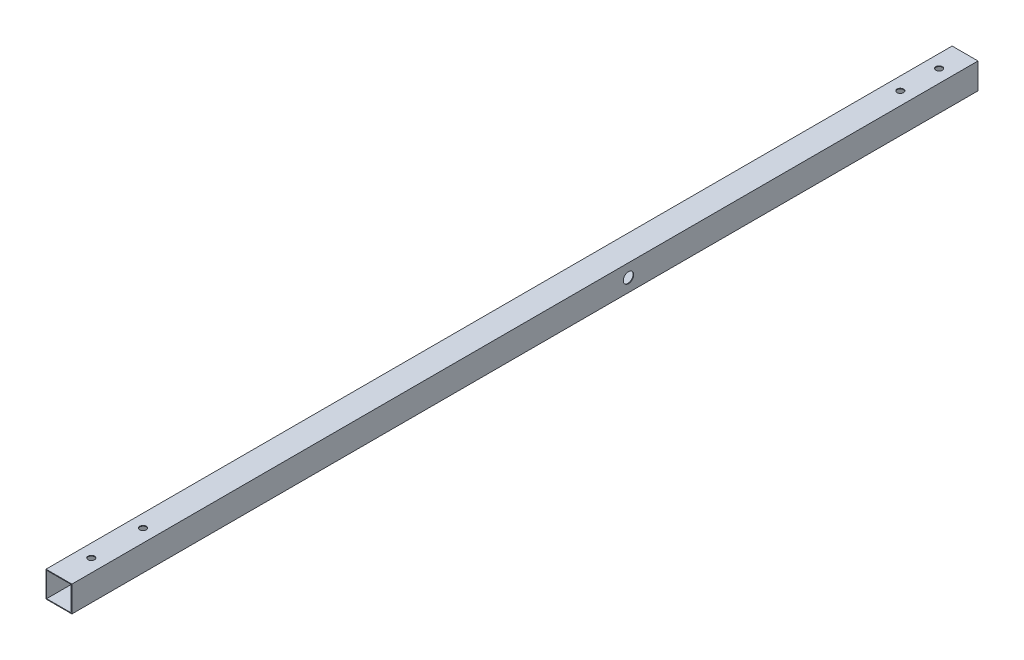
from build123d import *

# Parameters (mm, degrees)
SKETCH2_W           = 20
SKETCH2_H           = 20
BOSS_EXTRUDE1_DEPTH = 700
SKETCH3_W           = 19
SKETCH3_H           = 19
CUT_EXTRUDE1_DEPTH  = 700
SKETCH5_R           = 2.5
CUT_EXTRUDE2_DEPTH  = 20
SKETCH6_R           = 4
CUT_EXTRUDE3_DEPTH  = 20
SKETCH7_R           = 2.5
CUT_EXTRUDE4_DEPTH  = 20


with BuildPart() as part:
    # Sketch2 → Boss-Extrude1 (new body)
    with BuildSketch(Plane.XY):
        Rectangle(SKETCH2_W, SKETCH2_H)
    extrude(amount=BOSS_EXTRUDE1_DEPTH)

    # Sketch3 → Cut-Extrude1 (cut)
    with BuildSketch(Plane(origin=(0, 0, 0), x_dir=(-1, 0, 0), z_dir=(0, 0, -1))):
        Rectangle(SKETCH3_W, SKETCH3_H)
    extrude(amount=-CUT_EXTRUDE1_DEPTH, mode=Mode.SUBTRACT)

    # Sketch5 → Cut-Extrude2 (cut)
    with BuildSketch(Plane.XZ.offset(10)):
        with Locations(Location((0, 635, 0), (0, 0, 270))):
            Circle(SKETCH5_R)
        with Locations(Location((0, 675, 0), (0, 0, 270))):
            Circle(SKETCH5_R)
    extrude(amount=-CUT_EXTRUDE2_DEPTH, mode=Mode.SUBTRACT)

    # Sketch6 → Cut-Extrude3 (cut)
    with BuildSketch(Plane(origin=(10, 0, 0), x_dir=(0, 0, -1), z_dir=(1, 0, 0))):
        with Locations(Location((-270, 0, 0), (0, 0, 90))):
            Circle(SKETCH6_R)
    extrude(amount=-CUT_EXTRUDE3_DEPTH, mode=Mode.SUBTRACT)

    # Sketch7 → Cut-Extrude4 (cut)
    with BuildSketch(Plane.XZ.offset(10)):
        with Locations(Location((0, 20, 0), (0, 0, 270))):
            Circle(SKETCH7_R)
        with Locations(Location((0, 50, 0), (0, 0, 270))):
            Circle(SKETCH7_R)
    extrude(amount=-CUT_EXTRUDE4_DEPTH, mode=Mode.SUBTRACT)


solid = part.part
